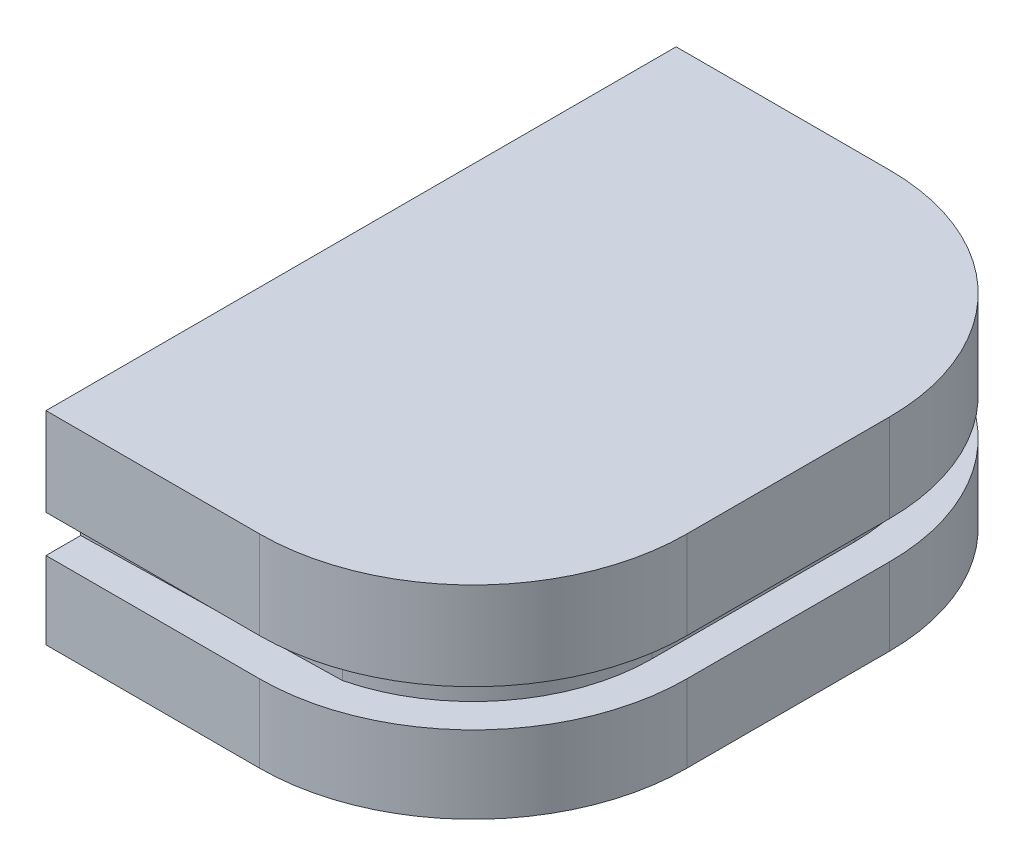
from build123d import *

# Parameters (mm, degrees)
SKETCH_1_W          = 8
SKETCH_1_H          = 11.8
EXTRUDE_1_DEPTH     = 3.8
FILLET_1_R          = 4
CUT_EXTRUDE_1_DEPTH = 0.35


with BuildPart() as part:
    # 草圖1 → 填料-伸長1 (new body)
    with BuildSketch(Plane(origin=(0, 0, 0), x_dir=(1, 0, 0), z_dir=(0, 1, 0))):
        with Locations((4, 5.9)):
            Rectangle(SKETCH_1_W, SKETCH_1_H)
    extrude(amount=EXTRUDE_1_DEPTH)

    # 圓角1
    fillet_1_edges = [part.edges().sort_by_distance(p)[0] for p in [
        (8, 1.9, -11.8),
        (8, 1.9, 0),
    ]]
    fillet(fillet_1_edges, radius=FILLET_1_R)

    # 草圖2 → 除料-伸長1 (cut, symmetric)
    with BuildSketch(Plane(origin=(0, 1.8, 0), x_dir=(1, 0, 0), z_dir=(0, 1, 0))):
        with BuildLine():
            Line((0, 11.8), (0, 11.025723127))
            Line((0, 11.025723127), (4.903996853, 11.025723127))
            ThreePointArc((4.903996853, 11.025723127), (6.669352867, 9.824118394), (7.35, 7.8))
            Line((7.35, 7.8), (7.35, 4))
            ThreePointArc((7.35, 4), (6.637408845, 1.934431172), (4.802791293, 0.74761224))
            Line((4.802791293, 0.74761224), (0, 0.65))
            Line((0, 0.65), (0, 0))
            Line((0, 0), (4, 0))
            ThreePointArc((4, 0), (6.828427125, 1.171572875), (8, 4))
            Line((8, 4), (8, 7.8))
            ThreePointArc((8, 7.8), (6.828427125, 10.628427125), (4, 11.8))
            Line((4, 11.8), (0, 11.8))
        make_face()
    extrude(amount=CUT_EXTRUDE_1_DEPTH, both=True, mode=Mode.SUBTRACT)


solid = part.part
